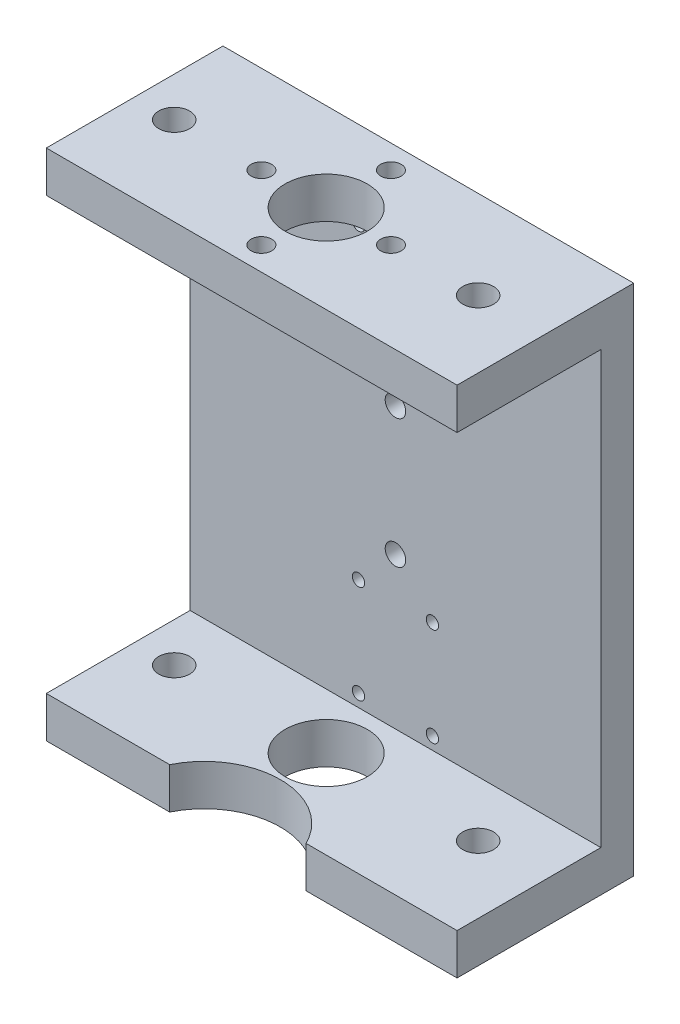
from build123d import *

# Parameters (mm, degrees)
SKETCH2_W           = 100
SKETCH2_H           = 125
SKETCH2_R           = 1.5
SKETCH2_R_2         = 2.5
BOSS_EXTRUDE1_DEPTH = 8
SKETCH5_W           = 100
SKETCH5_H           = 10
BOSS_EXTRUDE2_DEPTH = 35
SKETCH7_R           = 10
SKETCH7_R_2         = 3.75
CUT_EXTRUDE2_DEPTH  = 290
SKETCH8_R           = 18.5
CUT_EXTRUDE5_DEPTH  = 133.566964211
SKETCH9_R           = 2.5
CUT_EXTRUDE6_DEPTH  = 20


with BuildPart() as part:
    # Sketch2 → Boss-Extrude1 (new body)
    with BuildSketch(Plane.XY):
        with Locations((0, 17.5)):
            Rectangle(SKETCH2_W, SKETCH2_H)
        with Locations(Location((-9, -8.03563588, 0), (0, 0, 180))):
            Circle(SKETCH2_R, mode=Mode.SUBTRACT)
        with Locations(Location((9, -31.96436412, 0), (0, 0, 180))):
            Circle(SKETCH2_R, mode=Mode.SUBTRACT)
        with Locations((9, -8.03563588)):
            Circle(SKETCH2_R, mode=Mode.SUBTRACT)
        with Locations((-9, -31.96436412)):
            Circle(SKETCH2_R, mode=Mode.SUBTRACT)
        with Locations(Location((9, 43.03563588, 0), (0, 0, 180))):
            Circle(SKETCH2_R, mode=Mode.SUBTRACT)
        with Locations((-9, 43.03563588)):
            Circle(SKETCH2_R, mode=Mode.SUBTRACT)
        with Locations(Location((-9, 66.96436412, 0), (0, 0, 180))):
            Circle(SKETCH2_R, mode=Mode.SUBTRACT)
        with Locations((9, 66.96436412)):
            Circle(SKETCH2_R, mode=Mode.SUBTRACT)
        with Locations((0, 33.18)):
            Circle(SKETCH2_R_2, mode=Mode.SUBTRACT)
        with Locations((0, 1.82)):
            Circle(SKETCH2_R_2, mode=Mode.SUBTRACT)
    extrude(amount=BOSS_EXTRUDE1_DEPTH)

    # Sketch5 → Boss-Extrude2 (add)
    with BuildSketch(Plane.XY.offset(8)):
        with Locations((0, 75)):
            Rectangle(SKETCH5_W, SKETCH5_H)
        with Locations((0, -40)):
            Rectangle(SKETCH5_W, SKETCH5_H)
    extrude(amount=BOSS_EXTRUDE2_DEPTH)

    # Sketch7 → Cut-Extrude2 (cut)
    with BuildSketch(Plane(origin=(0, 80, 0), x_dir=(1, 0, 0), z_dir=(0, 1, 0))):
        with Locations(Location((-3.365, -21.5, 0), (0, 0, 270))):
            Circle(SKETCH7_R)
        with Locations(Location((-40.365, -21.5, 0), (0, 0, 270))):
            Circle(SKETCH7_R_2)
        with Locations(Location((33.635, -21.5, 0), (0, 0, 270))):
            Circle(SKETCH7_R_2)
    extrude(amount=-CUT_EXTRUDE2_DEPTH, mode=Mode.SUBTRACT)

    # Sketch8 → Cut-Extrude5 (cut, through all)
    with BuildSketch(Plane(origin=(0, -35, 0), x_dir=(1, 0, 0), z_dir=(0, 1, 0))):
        with Locations((-3.365, -51.164787316)):
            Circle(SKETCH8_R)
    extrude(amount=-CUT_EXTRUDE5_DEPTH, mode=Mode.SUBTRACT)

    # Sketch9 → Cut-Extrude6 (cut)
    with BuildSketch(Plane(origin=(0, 80, 0), x_dir=(1, 0, 0), z_dir=(0, 1, 0))):
        with Locations(Location((-3.365, -5.73, 0), (0, 0, 270))):
            Circle(SKETCH9_R)
        with Locations(Location((12.405, -21.5, 0), (0, 0, 270))):
            Circle(SKETCH9_R)
        with Locations(Location((-19.135, -21.5, 0), (0, 0, 180))):
            Circle(SKETCH9_R)
        with Locations(Location((-3.365, -37.27, 0), (0, 0, 180))):
            Circle(SKETCH9_R)
    extrude(amount=-CUT_EXTRUDE6_DEPTH, mode=Mode.SUBTRACT)


solid = part.part
